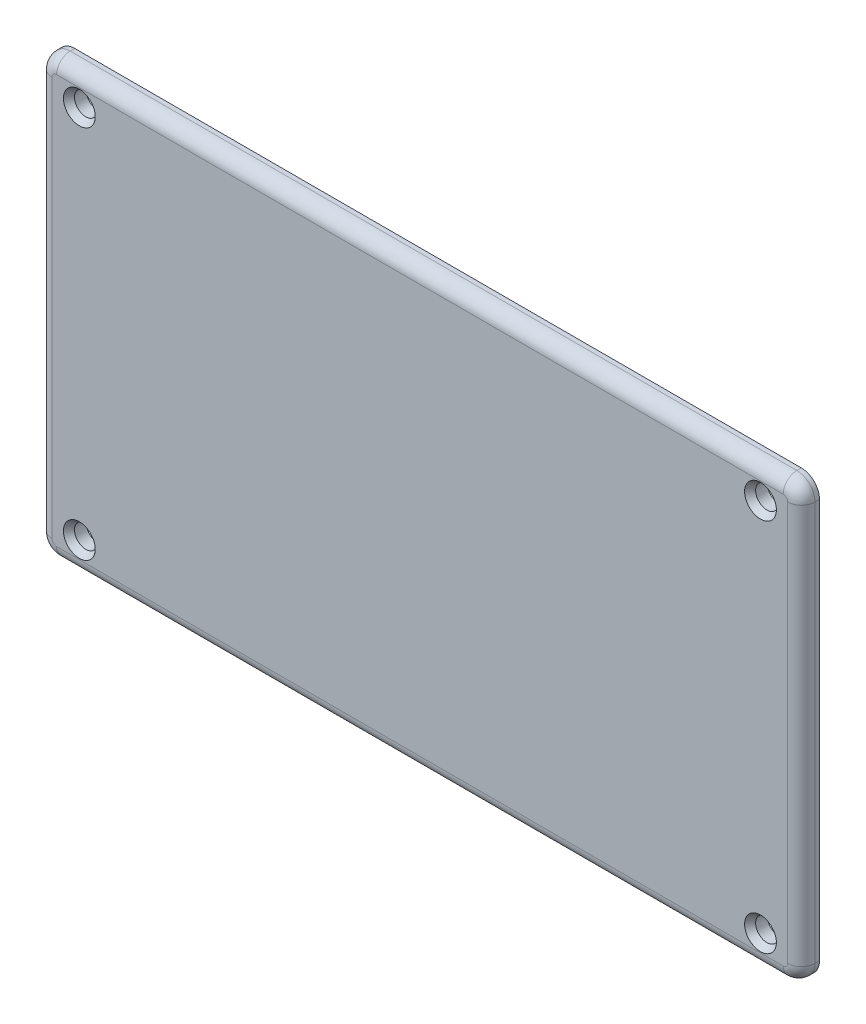
from build123d import *

# Parameters (mm, degrees)
SKETCH_2_R      = 1.25
EXTRUDE_1_DEPTH = 2
FILLET_1_R      = 1.5
CHAMFER_1_SIZE  = 0.5
CHAMFER_1_SIZE2 = 0.714074003


with BuildPart() as part:
    # 草图2 → 凸台-拉伸1 (new body)
    with BuildSketch(Plane.XY.offset(-23.385365979)):
        with BuildLine():
            Line((-42, 22), (-42, -22))
            ThreePointArc((-42, -22), (-41.414213562, -23.414213562), (-40, -24))
            Line((-40, -24), (40, -24))
            ThreePointArc((40, -24), (41.414213562, -23.414213562), (42, -22))
            Line((42, -22), (42, 22))
            ThreePointArc((42, 22), (41.414213562, 23.414213562), (40, 24))
            Line((40, 24), (-40, 24))
            ThreePointArc((-40, 24), (-41.414213562, 23.414213562), (-42, 22))
        make_face()
        with Locations((37.5, -20.625)):
            Circle(SKETCH_2_R, mode=Mode.SUBTRACT)
        with Locations((-37.5, -20.625)):
            Circle(SKETCH_2_R, mode=Mode.SUBTRACT)
        with Locations((37.5, 20.625)):
            Circle(SKETCH_2_R, mode=Mode.SUBTRACT)
        with Locations((-37.5, 20.625)):
            Circle(SKETCH_2_R, mode=Mode.SUBTRACT)
    extrude(amount=EXTRUDE_1_DEPTH)

    # 圆角1
    fillet_1_edges = [part.edges().sort_by_distance(p)[0] for p in [
        (-41.414213562, -23.414213562, -21.385365979),
        (0, -24, -21.385365979),
        (41.414213562, -23.414213562, -21.385365979),
        (42, 0, -21.385365979),
        (41.414213562, 23.414213562, -21.385365979),
        (0, 24, -21.385365979),
        (-41.414213562, 23.414213562, -21.385365979),
        (-42, 0, -21.385365979),
    ]]
    fillet(fillet_1_edges, radius=FILLET_1_R)

    # 倒角1
    chamfer_1_edges = [part.edges().sort_by_distance(p)[0] for p in [
        (36.25, -20.625, -21.385365979),
        (-38.75, -20.625, -21.385365979),
        (36.25, 20.625, -21.385365979),
        (-38.75, 20.625, -21.385365979),
    ]]
    chamfer_1_side = [part.faces().sort_by_distance(p)[0] for p in [
        (0, 0, -21.385365979),
    ]]
    chamfer(chamfer_1_edges, length=CHAMFER_1_SIZE, length2=CHAMFER_1_SIZE2, reference=chamfer_1_side[0])


solid = part.part
